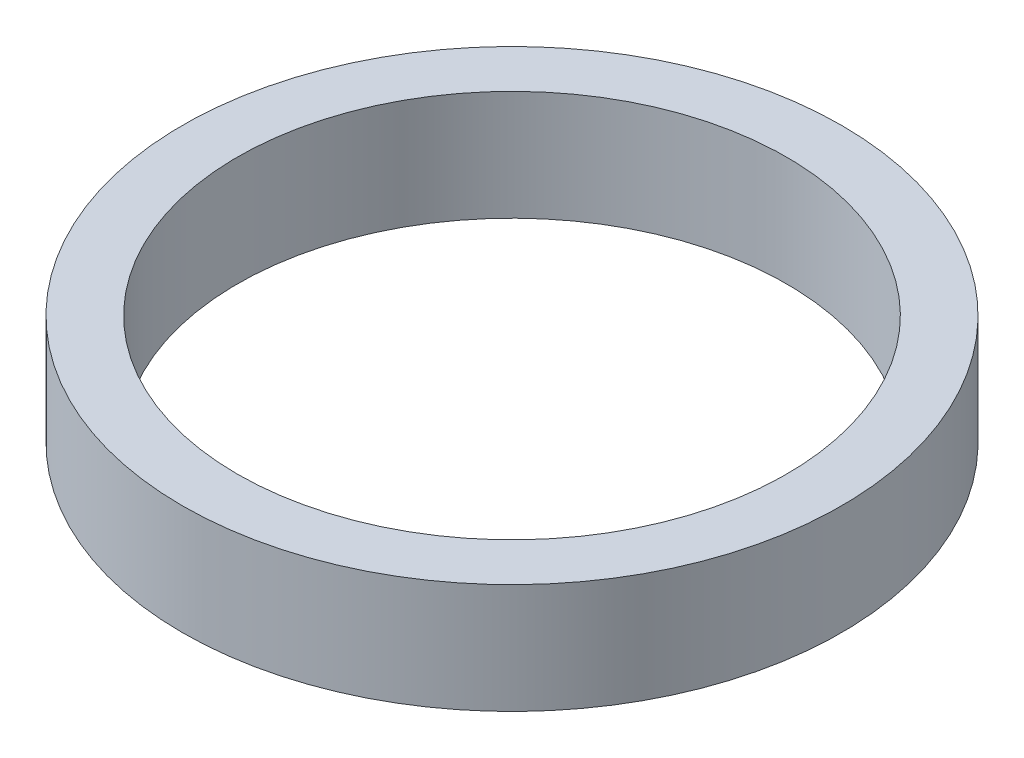
from build123d import *

# Parameters (mm, degrees)
SKETCH2_R           = 15
SKETCH2_R_2         = 12.5
BOSS_EXTRUDE1_DEPTH = 5


with BuildPart() as part:
    # Sketch2 → Boss-Extrude1 (new body)
    with BuildSketch(Plane(origin=(0, 0, 0), x_dir=(1, 0, 0), z_dir=(0, 1, 0))):
        with Locations(Location((0, 0, 0), (0, 0, 270))):
            Circle(SKETCH2_R)
        with Locations(Location((0, 0, 0), (0, 0, 270))):
            Circle(SKETCH2_R_2, mode=Mode.SUBTRACT)
    extrude(amount=BOSS_EXTRUDE1_DEPTH)


solid = part.part
